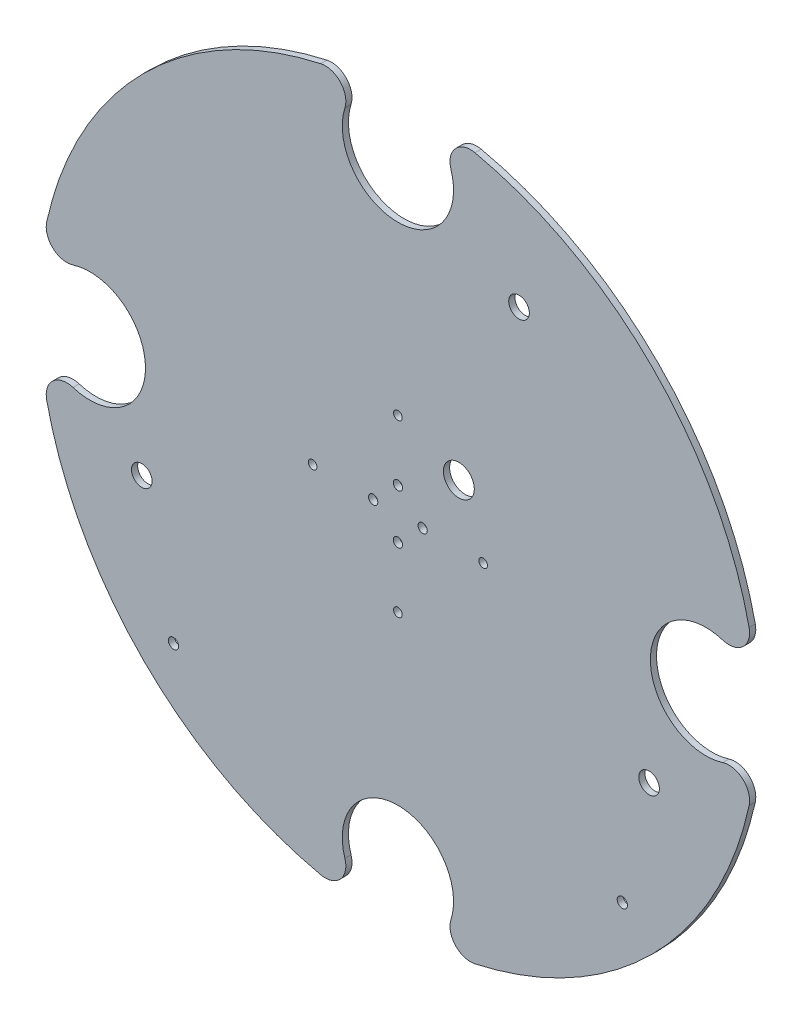
from build123d import *

# Parameters (mm, degrees)
SKETCH1_R           = 2.5
SKETCH1_R_2         = 5
SKETCH1_R_3         = 2.1
SKETCH1_R_4         = 2.25
SKETCH1_R_5         = 7.5
BOSS_EXTRUDE2_DEPTH = 3


with BuildPart() as part:
    # Sketch1 → Boss-Extrude2 (new body)
    with BuildSketch(Plane.XY):
        with BuildLine():
            ThreePointArc((-157.653936545, -25.739334079), (-167.417194297, -27.888102395), (-170.441324171, -37.416640882))
            ThreePointArc((-170.441324171, -37.416640882), (-123.390133317, -123.390133317), (-37.416640882, -170.441324171))
            ThreePointArc((-37.416640882, -170.441324171), (-27.888102395, -167.417194297), (-25.739334079, -157.653936545))
            ThreePointArc((-25.739334079, -157.653936545), (0, -122.5), (25.739334079, -157.653936545))
            ThreePointArc((25.739334079, -157.653936545), (27.888102395, -167.417194297), (37.416640882, -170.441324171))
            ThreePointArc((37.416640882, -170.441324171), (123.390133317, -123.390133317), (170.441324171, -37.416640882))
            ThreePointArc((170.441324171, -37.416640882), (167.417194297, -27.888102395), (157.653936545, -25.739334079))
            ThreePointArc((157.653936545, -25.739334079), (122.5, 0), (157.653936545, 25.739334079))
            ThreePointArc((157.653936545, 25.739334079), (167.417194297, 27.888102395), (170.441324171, 37.416640882))
            ThreePointArc((170.441324171, 37.416640882), (123.390133317, 123.390133317), (37.416640882, 170.441324171))
            ThreePointArc((37.416640882, 170.441324171), (27.888102395, 167.417194297), (25.739334079, 157.653936545))
            ThreePointArc((25.739334079, 157.653936545), (0, 122.5), (-25.739334079, 157.653936545))
            ThreePointArc((-25.739334079, 157.653936545), (-27.888102395, 167.417194297), (-37.416640882, 170.441324171))
            ThreePointArc((-37.416640882, 170.441324171), (-123.390133317, 123.390133317), (-170.441324171, 37.416640882))
            ThreePointArc((-170.441324171, 37.416640882), (-167.417194297, 27.888102395), (-157.653936545, 25.739334079))
            ThreePointArc((-157.653936545, 25.739334079), (-122.5, 0), (-157.653936545, -25.739334079))
        make_face()
        with Locations((-108.894444303, -108.894444303)):
            Circle(SKETCH1_R, mode=Mode.SUBTRACT)
        with Locations((-124.289525039, -46.039349088)):
            Circle(SKETCH1_R_2, mode=Mode.SUBTRACT)
        with Locations((0, -41.37)):
            Circle(SKETCH1_R_3, mode=Mode.SUBTRACT)
        with Locations((108.894444303, -108.894444303)):
            Circle(SKETCH1_R, mode=Mode.SUBTRACT)
        with Locations((0, -12)):
            Circle(SKETCH1_R_4, mode=Mode.SUBTRACT)
        with Locations((121.873399663, -52.131018514)):
            Circle(SKETCH1_R_2, mode=Mode.SUBTRACT)
        with Locations((-41.37, 0)):
            Circle(SKETCH1_R_3, mode=Mode.SUBTRACT)
        with Locations((-12, 0)):
            Circle(SKETCH1_R_4, mode=Mode.SUBTRACT)
        with Locations((12, 0)):
            Circle(SKETCH1_R_4, mode=Mode.SUBTRACT)
        with Locations((0, 12)):
            Circle(SKETCH1_R_4, mode=Mode.SUBTRACT)
        with Locations((41.37, 0)):
            Circle(SKETCH1_R_3, mode=Mode.SUBTRACT)
        with Locations((0, 41.37)):
            Circle(SKETCH1_R_3, mode=Mode.SUBTRACT)
        with Locations((29.572812598, 28.929667386)):
            Circle(SKETCH1_R_5, mode=Mode.SUBTRACT)
        with Locations((58.775444452, 116.257983948)):
            Circle(SKETCH1_R_2, mode=Mode.SUBTRACT)
    extrude(amount=BOSS_EXTRUDE2_DEPTH)


solid = part.part
